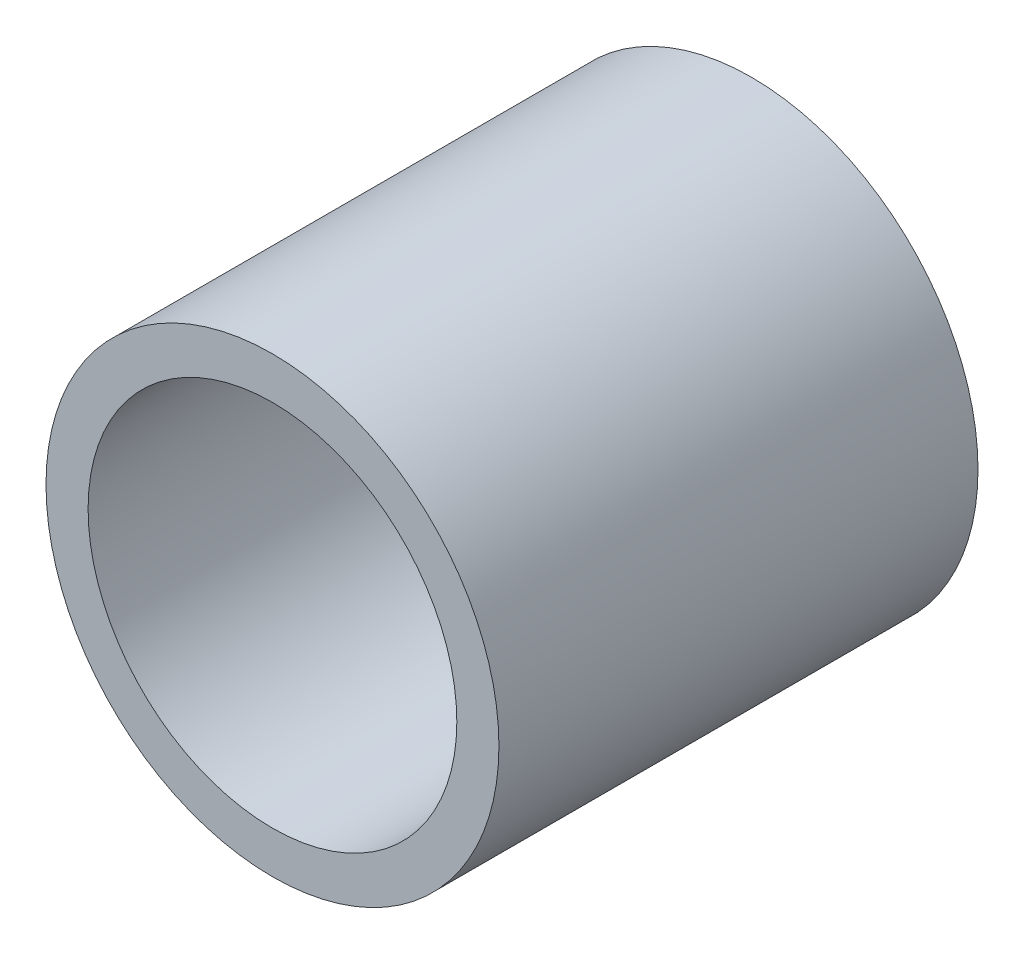
from build123d import *

# Parameters (mm, degrees)
SKETCH_1_R      = 15.6
SKETCH_1_R_2    = 12.6
SKETCH_1_R_3    = 6.3
SKETCH_1_R_4    = 1.65
EXTRUDE_1_DEPTH = 3
SKETCH_2_R      = 15.6
SKETCH_2_R_2    = 12.7
EXTRUDE_2_DEPTH = 30


with BuildPart() as part:
    # 草图1 → 凸台-拉伸1 (new body)
    # profile 1 of 2: a face of its own
    with BuildSketch(Plane.XY):
        Circle(SKETCH_1_R)
        Circle(SKETCH_1_R_2, mode=Mode.SUBTRACT)
    # profile 2 of 2: a face of its own
    with BuildSketch(Plane.XY):
        Circle(SKETCH_1_R_2)
        Circle(SKETCH_1_R_3, mode=Mode.SUBTRACT)
        with Locations((-9, 0)):
            Circle(SKETCH_1_R_4, mode=Mode.SUBTRACT)
        with Locations((9, 0)):
            Circle(SKETCH_1_R_4, mode=Mode.SUBTRACT)
    extrude(amount=EXTRUDE_1_DEPTH)

    # 草图2 → 凸台-拉伸2 (add)
    with BuildSketch(Plane.XY.offset(3)):
        Circle(SKETCH_2_R)
        Circle(SKETCH_2_R_2, mode=Mode.SUBTRACT)
    extrude(amount=EXTRUDE_2_DEPTH)


solid = part.part
